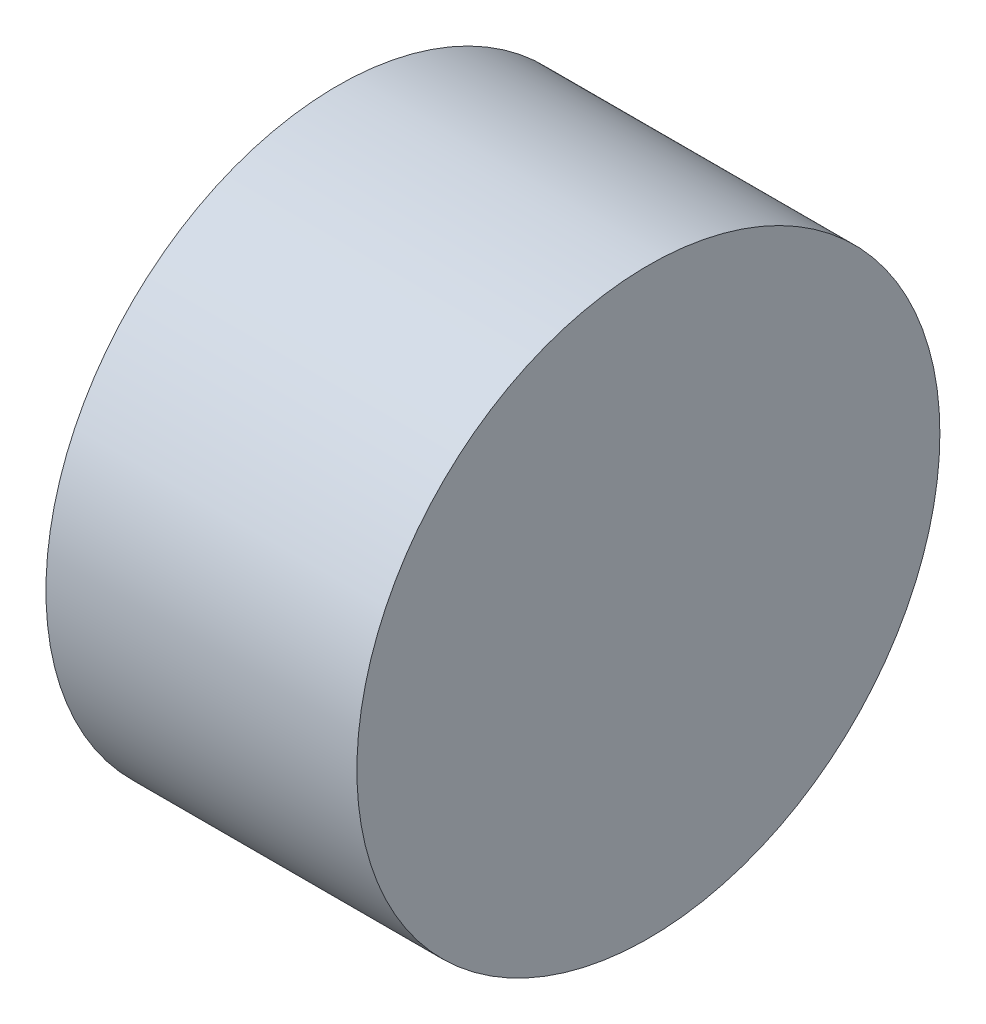
from build123d import *

# Parameters (mm, degrees)
SKETCH1_R           = 11.25
BOSS_EXTRUDE1_DEPTH = 12


with BuildPart() as part:
    # Sketch1 → Boss-Extrude1 (new body)
    with BuildSketch(Plane(origin=(-28.927963964, 0, 0), x_dir=(4.691478083755481e-12, 0, -1.0), z_dir=(1.0, 2.708687525006113e-12, 4.691478083755481e-12))):
        with Locations((-285.214044325, 803.467614781)):
            Circle(SKETCH1_R)
    extrude(amount=BOSS_EXTRUDE1_DEPTH)


solid = part.part
